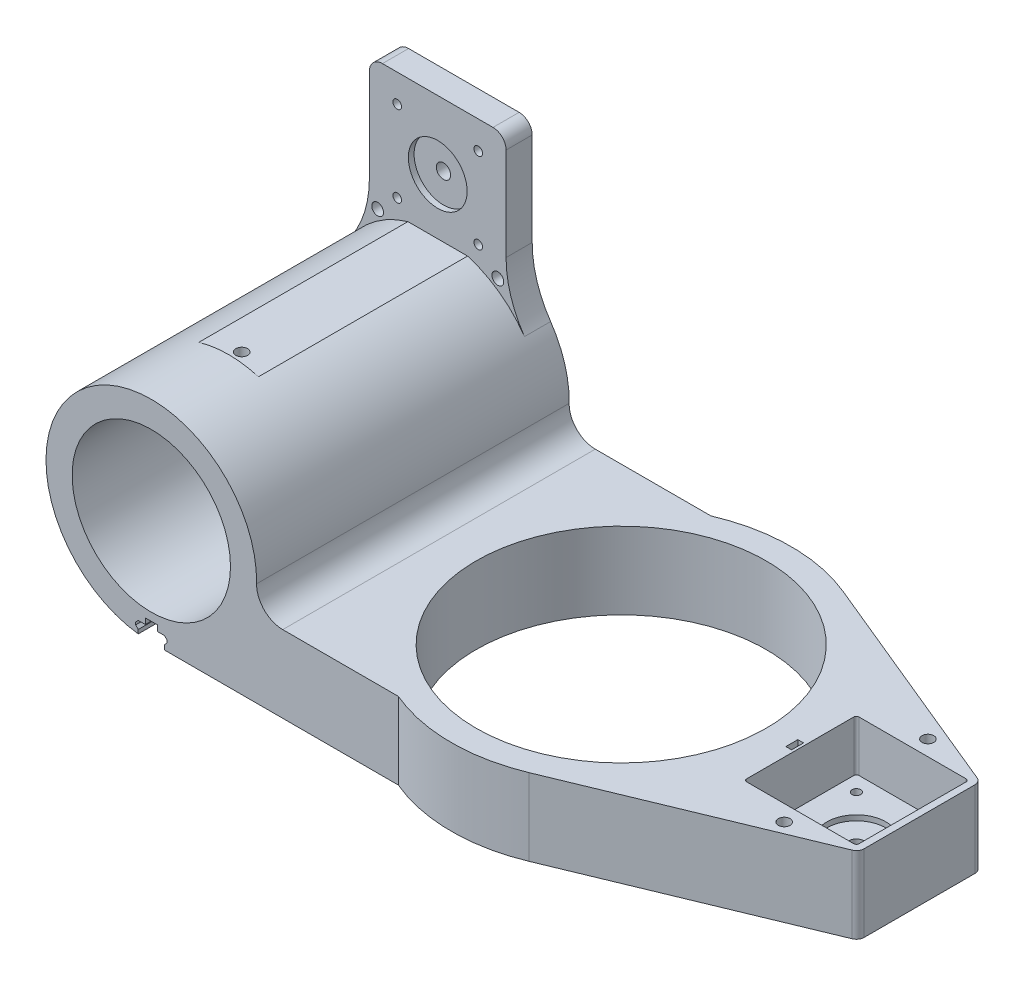
from build123d import *

# Parameters (mm, degrees)
SKETCH1_R           = 55.5
BOSS_EXTRUDE1_DEPTH = 29.4
CUT_EXTRUDE1_DEPTH  = 19.4
SKETCH3_R           = 1.65
SKETCH3_R_2         = 2.8
CUT_EXTRUDE2_DEPTH  = 133.783969288
SKETCH4_R           = 11.3
CUT_EXTRUDE3_DEPTH  = 2
SKETCH5_R           = 3.3
CUT_EXTRUDE4_DEPTH  = 5
SKETCH6_R           = 40.3
SKETCH6_R_2         = 30.3
BOSS_EXTRUDE2_DEPTH = 59.8
BOSS_EXTRUDE3_DEPTH = 119.6
BOSS_EXTRUDE4_START = -29.4
BOSS_EXTRUDE4_DEPTH = 29.4
FILLET1_R           = 10
SKETCH9_W           = 2.2
SKETCH9_H           = 4.6
CUT_EXTRUDE5_DEPTH  = 11.5
SKETCH10_R          = 2.25
CUT_EXTRUDE6_DEPTH  = 8
SKETCH12_W          = 52.3
SKETCH12_H          = 55.486218433
SKETCH12_R          = 2.75
BOSS_EXTRUDE5_DEPTH = 10
SKETCH13_R          = 1.65
CUT_EXTRUDE7_DEPTH  = 240.292148847
SKETCH14_R          = 3.3
CUT_EXTRUDE8_DEPTH  = 6
SKETCH15_W          = 42.7
SKETCH15_H          = 42.7
CUT_EXTRUDE9_DEPTH  = 80
FILLET2_R           = 40
FILLET3_R           = 5
SKETCH16_R          = 2.25
CUT_EXTRUDE10_DEPTH = 4
SKETCH17_R          = 2.25
CUT_EXTRUDE11_DEPTH = 7
CUT_EXTRUDE14_DEPTH = 20
SKETCH20_R          = 11.25
CUT_EXTRUDE15_DEPTH = 2.2


with BuildPart() as part:
    # Sketch1 → Boss-Extrude1 (new body)
    with BuildSketch(Plane(origin=(0, 0, 0), x_dir=(1, 0, 0), z_dir=(0, 1, 0))):
        with BuildLine():
            Line((24.826614984, -60.071950097), (112.295843768, -23.922551543))
            ThreePointArc((112.295843768, -23.922551543), (113.643745306, -22.817703315), (114.15, -21.15))
            Line((114.15, -21.15), (114.15, 21.15))
            ThreePointArc((114.15, 21.15), (113.643745306, 22.817703315), (112.295843768, 23.922551543))
            Line((112.295843768, 23.922551543), (24.826614984, 60.071950097))
            ThreePointArc((24.826614984, 60.071950097), (-65, 0), (24.826614984, -60.071950097))
        make_face()
        with Locations(Location((0, 0, 0), (0, 0, 270))):
            Circle(SKETCH1_R, mode=Mode.SUBTRACT)
    extrude(amount=BOSS_EXTRUDE1_DEPTH)

    # Sketch2 → Cut-Extrude1 (cut)
    with BuildSketch(Plane(origin=(0, 29.4, 0), x_dir=(1, 0, 0), z_dir=(0, 1, 0))):
        with BuildLine():
            Line((69.5, 21.5), (110.5, 21.5))
            ThreePointArc((110.5, 21.5), (111.207106781, 21.207106781), (111.5, 20.5))
            Line((111.5, 20.5), (111.5, -20.5))
            ThreePointArc((111.5, -20.5), (111.207106781, -21.207106781), (110.5, -21.5))
            Line((110.5, -21.5), (69.5, -21.5))
            ThreePointArc((69.5, -21.5), (68.792893219, -21.207106781), (68.5, -20.5))
            Line((68.5, -20.5), (68.5, 20.5))
            ThreePointArc((68.5, 20.5), (68.792893219, 21.207106781), (69.5, 21.5))
        make_face()
    extrude(amount=-CUT_EXTRUDE1_DEPTH, mode=Mode.SUBTRACT)

    # Sketch3 → Cut-Extrude2 (cut, through all)
    with BuildSketch(Plane(origin=(0, 10, 0), x_dir=(1, 0, 0), z_dir=(0, 1, 0))):
        with Locations(Location((74.5, -15.5, 0), (0, 0, 270))):
            Circle(SKETCH3_R)
        with Locations(Location((105.5, -15.5, 0), (0, 0, 270))):
            Circle(SKETCH3_R)
        with Locations(Location((105.5, 15.5, 0), (0, 0, 270))):
            Circle(SKETCH3_R)
        with Locations(Location((74.5, 15.5, 0), (0, 0, 270))):
            Circle(SKETCH3_R)
        with Locations(Location((90, 0, 0), (0, 0, 270))):
            Circle(SKETCH3_R_2)
    extrude(amount=-CUT_EXTRUDE2_DEPTH, mode=Mode.SUBTRACT)

    # Sketch4 → Cut-Extrude3 (cut)
    with BuildSketch(Plane(origin=(0, 10, 0), x_dir=(1, 0, 0), z_dir=(0, 1, 0))):
        with Locations(Location((90, 0, 0), (0, 0, 270))):
            Circle(SKETCH4_R)
    extrude(amount=-CUT_EXTRUDE3_DEPTH, mode=Mode.SUBTRACT)

    # Sketch5 → Cut-Extrude4 (cut)
    with BuildSketch(Plane.XZ):
        with Locations(Location((74.5, 15.5, 0), (0, 0, 270))):
            Circle(SKETCH5_R)
        with Locations(Location((105.5, 15.5, 0), (0, 0, 270))):
            Circle(SKETCH5_R)
        with Locations(Location((74.5, -15.5, 0), (0, 0, 270))):
            Circle(SKETCH5_R)
        with Locations(Location((105.5, -15.5, 0), (0, 0, 270))):
            Circle(SKETCH5_R)
    extrude(amount=-CUT_EXTRUDE4_DEPTH, mode=Mode.SUBTRACT)



with BuildPart() as body_2:
    # Sketch6 → Boss-Extrude2 (new, symmetric)
    with BuildSketch(Plane.XY):
        with Locations((-120, 40.3)):
            Circle(SKETCH6_R)
        with Locations((-120, 40.3)):
            Circle(SKETCH6_R_2, mode=Mode.SUBTRACT)
    extrude(amount=BOSS_EXTRUDE2_DEPTH, both=True)

    # Sketch7 → Boss-Extrude3 (add)
    with BuildSketch(Plane.XY.offset(59.8)):
        with BuildLine():
            Line((-65, 29.4), (-65, 0))
            Line((-65, 0), (-120, 0))
            ThreePointArc((-120, 0), (-95.660525889, 8.18022416), (-81.20206191, 29.4))
            Line((-81.20206191, 29.4), (-65, 29.4))
        make_face()
    extrude(amount=-BOSS_EXTRUDE3_DEPTH)


with BuildPart() as part_1:
    add(part.part)

    add(body_2.part)  # Boss-Extrude4 merges body 2
    # Sketch8 → Boss-Extrude4 (add)
    with BuildSketch(Plane(origin=(0, 29.4, 0), x_dir=(1, 0, 0), z_dir=(0, 1, 0)).offset(BOSS_EXTRUDE4_START)):
        with BuildLine():
            ThreePointArc((-25.474693325, -59.8), (-54.225709183, -35.840932794), (-65, 1.13e-07))
            Line((-65, 1.13e-07), (-65, -59.8))
            Line((-65, -59.8), (-25.474693325, -59.8))
        make_face()
        with BuildLine():
            Line((-25.474693325, 59.8), (-65, 59.8))
            Line((-65, 59.8), (-65, 1.13e-07))
            ThreePointArc((-65, 1.13e-07), (-54.225709121, 35.840932889), (-25.474693325, 59.8))
        make_face()
    extrude(amount=BOSS_EXTRUDE4_DEPTH)

    # Fillet1
    fillet1_edges = [part_1.edges().sort_by_distance(p)[0] for p in [
        (-81.20206191, 29.4, 0),
    ]]
    fillet(fillet1_edges, radius=FILLET1_R)

    # Sketch9 → Cut-Extrude5 (cut)
    with BuildSketch(Plane(origin=(0, 29.4, 0), x_dir=(1, 0, 0), z_dir=(0, 1, 0))):
        with Locations((66.4, 0)):
            Rectangle(SKETCH9_W, SKETCH9_H)
    extrude(amount=-CUT_EXTRUDE5_DEPTH, mode=Mode.SUBTRACT)

    # Sketch10 → Cut-Extrude6 (cut)
    with BuildSketch(Plane(origin=(0, 29.4, 0), x_dir=(1, 0, 0), z_dir=(0, 1, 0))):
        with Locations(Location((90, -27.612605503, 0), (0, 0, 270))):
            Circle(SKETCH10_R)
        with Locations(Location((90, 27.387394497, 0), (0, 0, 270))):
            Circle(SKETCH10_R)
    extrude(amount=-CUT_EXTRUDE6_DEPTH, mode=Mode.SUBTRACT)

    # Sketch12 → Boss-Extrude5 (add)
    with BuildSketch(Plane(origin=(0, 0, -59.8), x_dir=(-1, 0, 0), z_dir=(0, 0, -1))):
        with Locations((120, 98.706890784)):
            Rectangle(SKETCH12_W, SKETCH12_H)
        with Locations((120, 100.3)):
            Circle(SKETCH12_R, mode=Mode.SUBTRACT)
    extrude(amount=-BOSS_EXTRUDE5_DEPTH)

    # Sketch13 → Cut-Extrude7 (cut, through all)
    with BuildSketch(Plane(origin=(0, 0, -59.8), x_dir=(-1, 0, 0), z_dir=(0, 0, -1))):
        with Locations((104.5, 115.8)):
            Circle(SKETCH13_R)
        with Locations((104.5, 84.8)):
            Circle(SKETCH13_R)
        with Locations((135.5, 84.8)):
            Circle(SKETCH13_R)
        with Locations((135.5, 115.8)):
            Circle(SKETCH13_R)
    extrude(amount=-CUT_EXTRUDE7_DEPTH, mode=Mode.SUBTRACT)

    # Sketch14 → Cut-Extrude8 (cut)
    with BuildSketch(Plane(origin=(0, 0, -59.8), x_dir=(-1, 0, 0), z_dir=(0, 0, -1))):
        with Locations((104.5, 115.8)):
            Circle(SKETCH14_R)
        with Locations((104.5, 84.8)):
            Circle(SKETCH14_R)
        with Locations((135.5, 84.8)):
            Circle(SKETCH14_R)
        with Locations((135.5, 115.8)):
            Circle(SKETCH14_R)
    extrude(amount=-CUT_EXTRUDE8_DEPTH, mode=Mode.SUBTRACT)

    # Sketch15 → Cut-Extrude9 (cut)
    with BuildSketch(Plane.XY.offset(-49.8)):
        with Locations((-120, 100.3)):
            Rectangle(SKETCH15_W, SKETCH15_H)
    extrude(amount=CUT_EXTRUDE9_DEPTH, mode=Mode.SUBTRACT)

    # Fillet2
    fillet2_edges = [part_1.edges().sort_by_distance(p)[0] for p in [
        (-93.85, 70.963781567, -54.8),
        (-146.15, 70.963781567, -54.8),
    ]]
    fillet(fillet2_edges, radius=FILLET2_R)

    # Fillet3
    fillet3_edges = [part_1.edges().sort_by_distance(p)[0] for p in [
        (-93.85, 126.45, -54.8),
        (-146.15, 126.45, -54.8),
    ]]
    fillet(fillet3_edges, radius=FILLET3_R)

    # Sketch16 → Cut-Extrude10 (cut)
    with BuildSketch(Plane.XY.offset(-49.8)):
        with Locations((-143, 77.3)):
            Circle(SKETCH16_R)
        with Locations((-97, 77.3)):
            Circle(SKETCH16_R)
    extrude(amount=-CUT_EXTRUDE10_DEPTH, mode=Mode.SUBTRACT)

    # Sketch17 → Cut-Extrude11 (cut)
    with BuildSketch(Plane(origin=(0, 78.95, 0), x_dir=(1, 0, 0), z_dir=(0, 1, 0))):
        with Locations(Location((-120, -25.2, 0), (0, 0, 270))):
            Circle(SKETCH17_R)
    extrude(amount=-CUT_EXTRUDE11_DEPTH, mode=Mode.SUBTRACT)

    # Sketch18 → Cut-Extrude14 (cut)
    with BuildSketch(Plane.XY.offset(59.8)):
        Polygon((-122.3, 7), (-117.7, 7), (-117.7, 4.8), (-115, 4.8), (-114, 3.8), (-114, 2.8), (-115, 1.8), (-115, 0), (-125, 0), (-125, 1.8), (-126, 2.8), (-126, 3.8), (-125, 4.8), (-122.3, 4.8), align=None)
    extrude(amount=-CUT_EXTRUDE14_DEPTH, mode=Mode.SUBTRACT)

    # Sketch20 → Cut-Extrude15 (cut)
    with BuildSketch(Plane.XY.offset(-49.8)):
        with Locations((-120, 100.3)):
            Circle(SKETCH20_R)
    extrude(amount=-CUT_EXTRUDE15_DEPTH, mode=Mode.SUBTRACT)


solid = part_1.part
